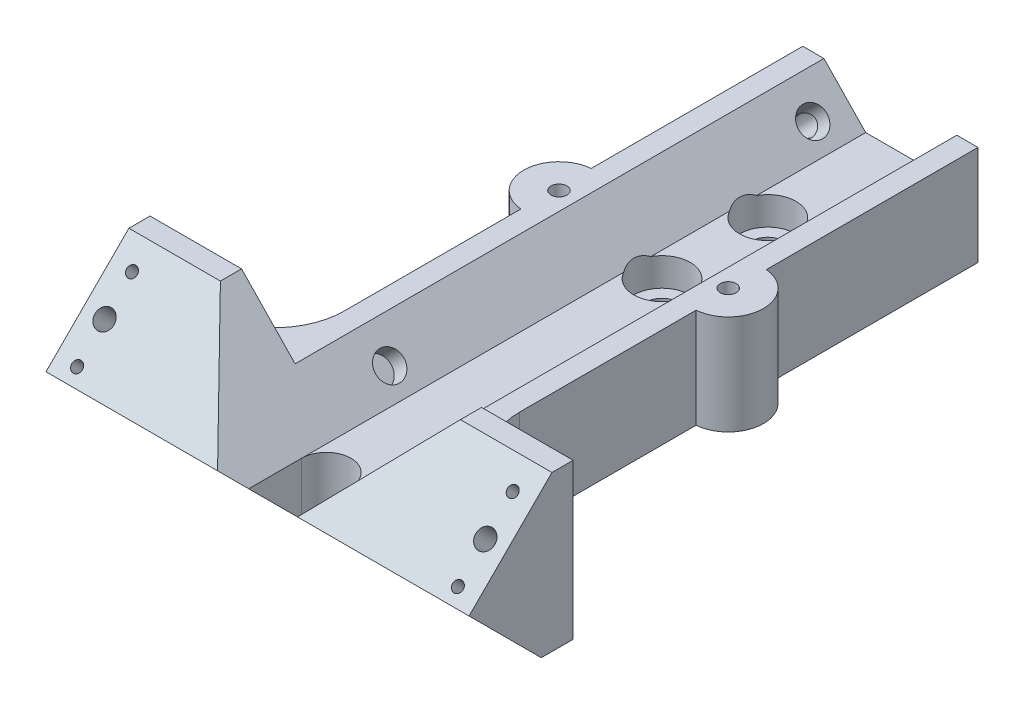
from build123d import *

# Parameters (mm, degrees)
BOSS_EXTRUDE1_DEPTH           = 75
BOSS_EXTRUDE2_DEPTH           = 25
FILLET1_R                     = 10
CUT_EXTRUDE1_DEPTH            = 117.89311357
CBORE_FOR_M4_SHCS1_AT_2_COUNT = 2
CBORE_FOR_M4_SHCS1_AT_2_PITCH = 15
SKETCH8_R                     = 2
CUT_EXTRUDE2_DEPTH            = 4
SKETCH27_R                    = 2
CUT_EXTRUDE8_DEPTH            = 4
SKETCH29_R                    = 2
CUT_EXTRUDE9_DEPTH            = 2.5
SKETCH30_R                    = 2
CUT_EXTRUDE10_DEPTH           = 2.5
F_6_32_TAPPED_HOLE4_D         = 2.7051
F_6_32_TAPPED_HOLE4_DEPTH     = 9.39
F_6_32_TAPPED_HOLE4_TIP       = 0.81269403
BOSS_EXTRUDE4_DEPTH           = 14.135517109
F_4_40_TAPPED_HOLE1_D         = 2.2606
BOSS_EXTRUDE3_DEPTH           = 60
CUT_EXTRUDE3_DEPTH            = 118.45637488
CUT_EXTRUDE4_DEPTH            = 104.440804328
CUT_EXTRUDE5_DEPTH            = 104.440804328
F_6_32_TAPPED_HOLE3_D         = 2.7051
F_1_72_TAPPED_HOLE1_D         = 1.5113
SKETCH26_W                    = 78.957302066
SKETCH26_H                    = 14.945781294
CUT_EXTRUDE7_DEPTH            = 81.746516953
CUT_EXTRUDE11_START           = 10
SKETCH37_R                    = 4
CUT_EXTRUDE11_DEPTH           = 10


with BuildPart() as part:
    # Sketch1 → Boss-Extrude1 (new body)
    with BuildSketch(Plane.XY):
        Polygon((-3.5, 0), (3.5, 0), (9.425, 6.135517109), (12.425, 6.135517109), (12.425, -8), (-12.425, -8), (-12.425, 6.135517109), (-9.425, 6.135517109), align=None)
    extrude(amount=BOSS_EXTRUDE1_DEPTH)

    # Sketch2 → Boss-Extrude2 (add)
    with BuildSketch(Plane.XY.offset(75)):
        Polygon((-3.5, 0), (-9.425, 6.135517109), (-30, 6.135517109), (-30, -8), (30, -8), (30, 6.135517109), (9.425, 6.135517109), (3.5, 0), align=None)
    extrude(amount=BOSS_EXTRUDE2_DEPTH)

    # Fillet1
    fillet1_edges = [part.edges().sort_by_distance(p)[0] for p in [
        (-12.425, -0.932241445, 75),
        (12.425, -0.932241445, 75),
    ]]
    fillet(fillet1_edges, radius=FILLET1_R)

    # Sketch3 → Cut-Extrude1 (cut, through all)
    with BuildSketch(Plane(origin=(30, 0, 0), x_dir=(0, 0, -1), z_dir=(1, 0, 0))):
        Polygon((-100, -8), (-85.864482891, 6.135517109), (-100, 6.135517109), align=None)
    extrude(amount=-CUT_EXTRUDE1_DEPTH, mode=Mode.SUBTRACT)

    # Sketch6 → CBORE for M4 SHCS1 (revolve, cut)
    with BuildSketch(Plane(origin=(0, 0, 17.39), x_dir=(0, 0, 1), z_dir=(1, 0, 0))):
        Polygon((0, 0), (0, 8), (2.25, 8), (2.25, 4), (4, 4), (4, 0), align=None)
    cbore_for_m4_shcs1 = revolve(axis=Axis((0, 6.35, 17.39), (0, -1, 0)), mode=Mode.SUBTRACT)

    # CBORE for M4 SHCS1 at 2: CBORE for M4 SHCS1 ×2
    with Locations(*[(0, 0, i * CBORE_FOR_M4_SHCS1_AT_2_PITCH) for i in range(1, CBORE_FOR_M4_SHCS1_AT_2_COUNT)]):
        add(cbore_for_m4_shcs1, mode=Mode.SUBTRACT)

    # Sketch8 → Cut-Extrude2 (cut)
    with BuildSketch(Plane(origin=(1.811074119, -1.748933947, 0), x_dir=(0, 0, 1), z_dir=(-0.7193398003386524, 0.6946583704589959, 0))):
        with Locations(Location((5, 6.045178032, 0), (0, 0, 270))):
            Circle(SKETCH8_R)
    extrude(amount=-CUT_EXTRUDE2_DEPTH, mode=Mode.SUBTRACT)

    # Sketch27 → Cut-Extrude8 (cut)
    with BuildSketch(Plane(origin=(-1.811074119, -1.748933947, 0), x_dir=(0, 0, -1), z_dir=(0.7193398003386526, 0.6946583704589958, 0))):
        with Locations(Location((-5, 6.045178032, 0), (0, 0, 90))):
            Circle(SKETCH27_R)
    extrude(amount=-CUT_EXTRUDE8_DEPTH, mode=Mode.SUBTRACT)

    # Sketch29 → Cut-Extrude9 (cut)
    with BuildSketch(Plane(origin=(-1.811074119, -1.748933947, 0), x_dir=(0, 0, -1), z_dir=(0.7193398003386526, 0.6946583704589958, 0))):
        with Locations(Location((-65, 6.045178032, 0), (0, 0, 90))):
            Circle(SKETCH29_R)
    extrude(amount=-CUT_EXTRUDE9_DEPTH, mode=Mode.SUBTRACT)

    # Sketch30 → Cut-Extrude10 (cut)
    with BuildSketch(Plane(origin=(1.811074119, -1.748933947, 0), x_dir=(0, 0, 1), z_dir=(-0.7193398003386524, 0.6946583704589959, 0))):
        with Locations(Location((65, 6.045178032, 0), (0, 0, 270))):
            Circle(SKETCH30_R)
    extrude(amount=-CUT_EXTRUDE10_DEPTH, mode=Mode.SUBTRACT)

    # #6-32 Tapped Hole4
    with Locations(Plane(origin=(0, 0, 0), x_dir=(-1, 0, 0), z_dir=(0, 0, -1))):
        with Locations((-8.485281374, 0.124729477), (8.485281374, 0.124729477)):
            Hole(F_6_32_TAPPED_HOLE4_D / 2, depth=F_6_32_TAPPED_HOLE4_DEPTH)
            with Locations((0, 0, -(F_6_32_TAPPED_HOLE4_DEPTH + F_6_32_TAPPED_HOLE4_TIP / 2))):  # 118° drill point
                Cone(0, F_6_32_TAPPED_HOLE4_D / 2, F_6_32_TAPPED_HOLE4_TIP, mode=Mode.SUBTRACT)

    # Sketch33 → Boss-Extrude4 (add)
    with BuildSketch(Plane(origin=(0, 6.135517109, 0), x_dir=(1, 0, 0), z_dir=(0, 1, 0))):
        with BuildLine():
            Line((-12.425, -30.018095244), (-12.425, -39.981904756))
            ThreePointArc((-12.425, -39.981904756), (-17, -35), (-12.425, -30.018095244))
        make_face()
        with BuildLine():
            Line((12.425, -30.018095244), (12.425, -39.981904756))
            ThreePointArc((12.425, -39.981904756), (17, -35), (12.425, -30.018095244))
        make_face()
    extrude(amount=-BOSS_EXTRUDE4_DEPTH)

    # #4-40 Tapped Hole1 (through all)
    with Locations(Plane(origin=(0, 6.135517109, 0), x_dir=(1, 0, 0), z_dir=(0, 1, 0))):
        with Locations((-12, -35), (12, -35)):
            Hole(F_4_40_TAPPED_HOLE1_D / 2)

    # Sketch9 → Boss-Extrude3 (add)
    with BuildSketch(Plane(origin=(30, 0, 0), x_dir=(0, 0, -1), z_dir=(1, 0, 0))):
        Polygon((-85.864482891, 6.135517109), (-78, 14), (-75, 14), (-75, 6.135517109), align=None)
    extrude(amount=-BOSS_EXTRUDE3_DEPTH)

    # Sketch10 → Cut-Extrude3 (cut, through all)
    with BuildSketch(Plane(origin=(30, 0, 0), x_dir=(0, 0, -1), z_dir=(1, 0, 0))):
        Polygon((-100, -8), (-98, -6), (-98, -8), align=None)
    extrude(amount=-CUT_EXTRUDE3_DEPTH, mode=Mode.SUBTRACT)

    # Sketch11 → Cut-Extrude4 (cut, through all)
    with BuildSketch(Plane(origin=(0, 0, 0), x_dir=(-1, 0, 0), z_dir=(0, 0, -1))):
        Polygon((-3.5, 0), (3.5, 0), (17.019642847, 14), (-17.019642847, 14), align=None)
    extrude(amount=-CUT_EXTRUDE4_DEPTH, mode=Mode.SUBTRACT)

    # Sketch12 → Cut-Extrude5 (cut, through all)
    with BuildSketch(Plane(origin=(0, 0, 0), x_dir=(1, 0, 0), z_dir=(0, 1, 0))):
        with BuildLine():
            Line((3.5, -80), (3.5, -92))
            Line((3.5, -92), (-3.5, -92))
            Line((-3.5, -92), (-3.5, -80))
            ThreePointArc((-3.5, -80), (0, -76.5), (3.5, -80))
        make_face()
    extrude(amount=-CUT_EXTRUDE5_DEPTH, mode=Mode.SUBTRACT)

    # #6-32 Tapped Hole3 (through all)
    with Locations(Plane(origin=(0, 47.060660172, 47.060660172), x_dir=(1, 0, 0), z_dir=(0, 0.7071067811865434, 0.7071067811865517))):
        with Locations((-27, -54.377429751), (27, -54.377429751)):
            Hole(F_6_32_TAPPED_HOLE3_D / 2)

    # #1-72 Tapped Hole1 (through all)
    with Locations(Plane(origin=(0, 47.060660172, 47.060660172), x_dir=(1, 0, 0), z_dir=(0, 0.7071067811865434, 0.7071067811865517))):
        with Locations((-27, -48.877429751), (-27, -59.877429751), (27, -48.877429751), (27, -59.877429751)):
            Hole(F_1_72_TAPPED_HOLE1_D / 2)

    # Sketch26 → Cut-Extrude7 (cut, through all)
    with BuildSketch(Plane(origin=(0, 46, 46), x_dir=(1, 0, 0), z_dir=(0, 0.7071067811865434, 0.7071067811865517))):
        with Locations((0.61611421, -69.350320398)):
            Rectangle(SKETCH26_W, SKETCH26_H)
    extrude(amount=-CUT_EXTRUDE7_DEPTH, mode=Mode.SUBTRACT)

    # Sketch37 → Cut-Extrude11 (cut)
    with BuildSketch(Plane(origin=(0, 0, 0), x_dir=(1, 0, 0), z_dir=(0, 1, 0)).offset(CUT_EXTRUDE11_START)):
        with Locations(Location((0, -17.39, 0), (0, 0, 270))):
            Circle(SKETCH37_R)
        with Locations(Location((0, -32.39, 0), (0, 0, 270))):
            Circle(SKETCH37_R)
    extrude(amount=-CUT_EXTRUDE11_DEPTH, mode=Mode.SUBTRACT)


solid = part.part
